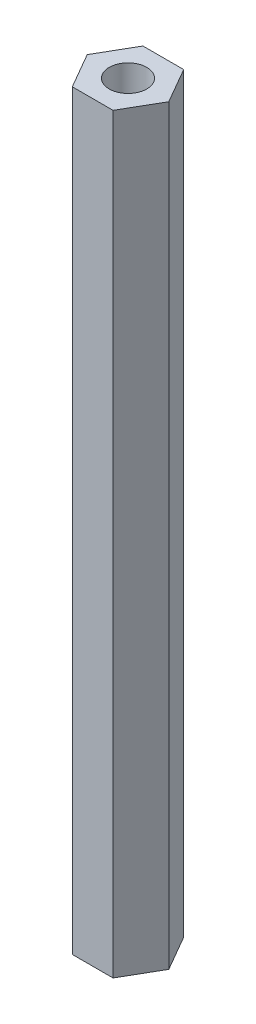
from build123d import *

# Parameters (mm, degrees)
EXTRUDE_1_DEPTH    = 50
HOLE_WIZARD_M3_1_D = 2.5


with BuildPart() as part:
    # 草图1 → 凸台-拉伸1 (new body)
    with BuildSketch(Plane(origin=(0, 0, 0), x_dir=(1, 0, 0), z_dir=(0, 1, 0))):
        Polygon((2.713546265, 0), (1.356773133, 2.35), (-1.356773133, 2.35), (-2.713546265, 0), (-1.356773133, -2.35), (1.356773133, -2.35), align=None)
    extrude(amount=EXTRUDE_1_DEPTH)

    # M3 螺纹孔1 (through all)
    with Locations(Plane(origin=(0, 50, 0), x_dir=(1, 0, 0), z_dir=(0, 1, 0))):
        with Locations((0, 0)):
            Hole(HOLE_WIZARD_M3_1_D / 2)


solid = part.part
